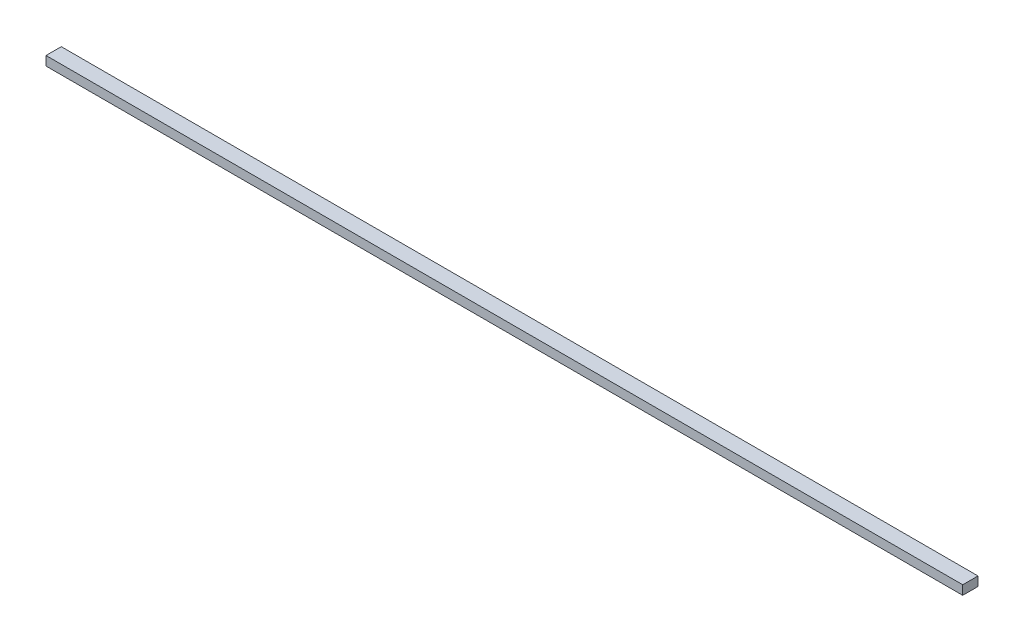
from build123d import *

# Parameters (mm, degrees)
SKETCH1_W           = 300
SKETCH1_H           = 5
BOSS_EXTRUDE1_DEPTH = 3


with BuildPart() as part:
    # Sketch1 → Boss-Extrude1 (new body)
    with BuildSketch(Plane(origin=(0, 0, 0), x_dir=(1, 0, 0), z_dir=(0, 1, 0))):
        with Locations((150, 2.5)):
            Rectangle(SKETCH1_W, SKETCH1_H)
    extrude(amount=BOSS_EXTRUDE1_DEPTH)


solid = part.part
